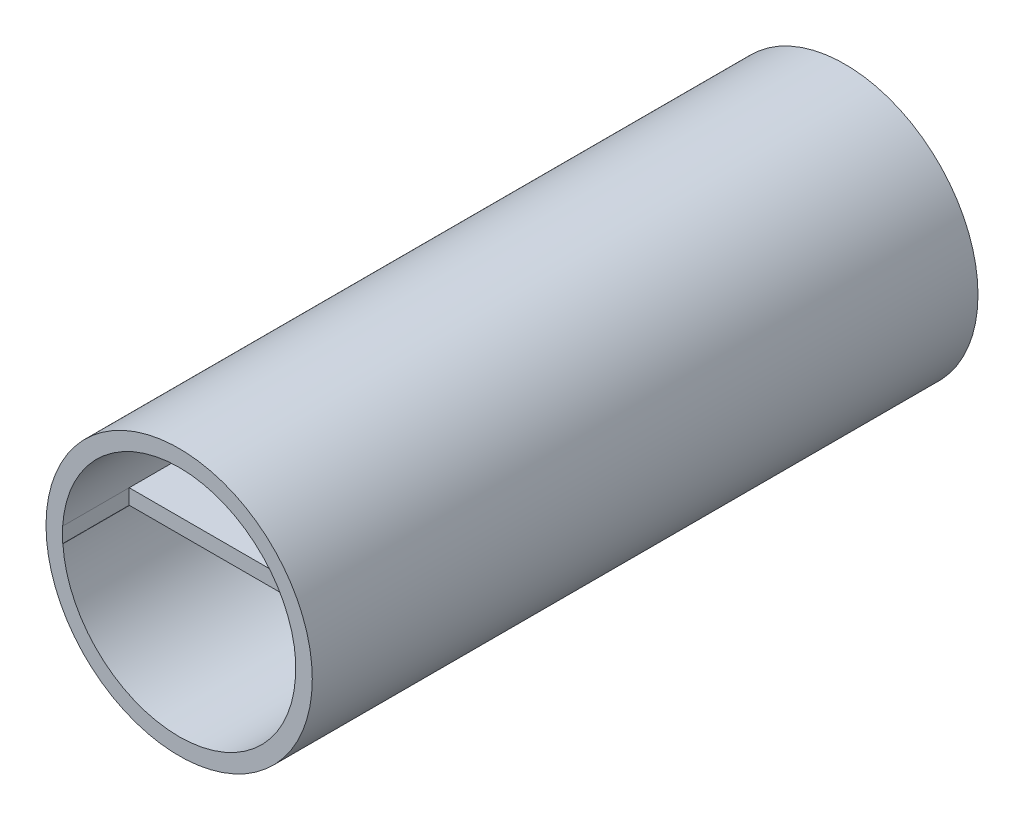
from build123d import *

# Parameters (mm, degrees)
SKETCH2_R           = 40
BOSS_EXTRUDE1_DEPTH = 100
SKETCH4_W           = 70
SKETCH4_H           = 4.556359802
CUT_EXTRUDE1_DEPTH  = 20
SKETCH5_W           = 70
SKETCH5_H           = 4.556359802
CUT_EXTRUDE2_DEPTH  = 20


with BuildPart() as part:
    # Sketch2 → Boss-Extrude1 (new, symmetric)
    with BuildSketch(Plane.XY):
        Circle(SKETCH2_R)
        with BuildLine():
            ThreePointArc((34.926090435, -2.273369064), (0, -35), (-34.926090435, -2.273369064))
            Line((-34.926090435, -2.273369064), (34.926090435, -2.273369064))
        make_face(mode=Mode.SUBTRACT)
        with BuildLine():
            Line((35, 2.278179901), (-35, 2.278179901))
            ThreePointArc((-35, 2.278179901), (0, 35.07406597), (35, 2.278179901))
        make_face(mode=Mode.SUBTRACT)
    extrude(amount=BOSS_EXTRUDE1_DEPTH, both=True)

    # Sketch4 → Cut-Extrude1 (cut)
    with BuildSketch(Plane.XY.offset(100)):
        Rectangle(SKETCH4_W, SKETCH4_H)
    extrude(amount=-CUT_EXTRUDE1_DEPTH, mode=Mode.SUBTRACT)

    # Sketch5 → Cut-Extrude2 (cut)
    with BuildSketch(Plane(origin=(0, 0, -100), x_dir=(-1, 0, 0), z_dir=(0, 0, -1))):
        Rectangle(SKETCH5_W, SKETCH5_H)
    extrude(amount=-CUT_EXTRUDE2_DEPTH, mode=Mode.SUBTRACT)


solid = part.part
